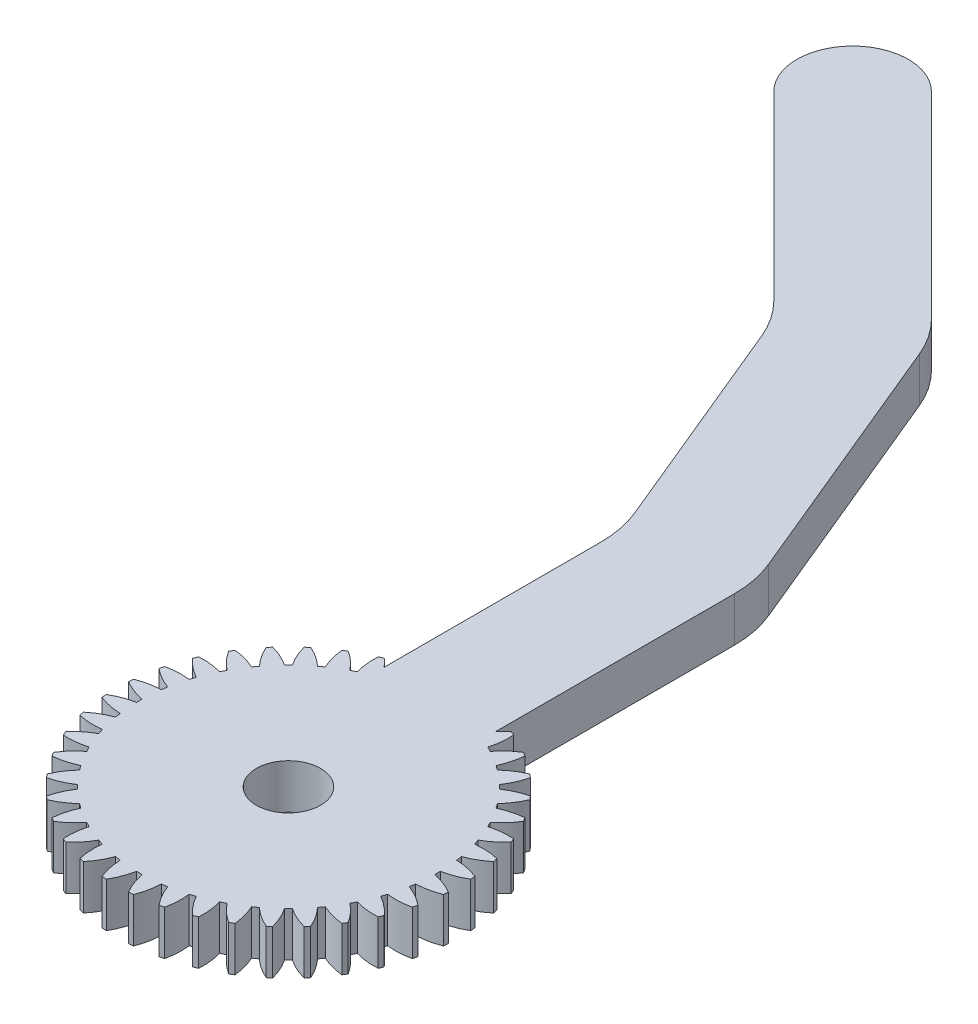
from build123d import *

# Parameters (mm, degrees)
SKETCH1_R           = 15.375
SKETCH1_R_2         = 2.875
BOSS_EXTRUDE1_DEPTH = 4
CUT_EXTRUDE1_DEPTH  = 23.108397726
CIRPATTERN1_COUNT   = 40
BOSS_EXTRUDE2_DEPTH = 4


with BuildPart() as part:
    # Sketch1 → Boss-Extrude1 (new body)
    with BuildSketch(Plane(origin=(0, 0, 0), x_dir=(1, 0, 0), z_dir=(0, 1, 0))):
        with Locations(Location((0, 0, 0), (0, 0, 270))):
            Circle(SKETCH1_R)
        with Locations(Location((0, 0, 0), (0, 0, 270))):
            Circle(SKETCH1_R_2, mode=Mode.SUBTRACT)
    extrude(amount=BOSS_EXTRUDE1_DEPTH)

    # Sketch2 → Cut-Extrude1 (cut, through all)
    with BuildSketch(Plane(origin=(0, 4, 0), x_dir=(1, 0, 0), z_dir=(0, 1, 0))):
        with BuildLine():
            Line((0, 15.375), (0, 13.375))
            ThreePointArc((0, 13.375), (0.12500546, 13.374415824), (0.25, 13.372663347))
            ThreePointArc((0.25, 13.372663347), (0.537827073, 14.390745616), (1, 15.342445209))
            ThreePointArc((1, 15.342445209), (0.500264883, 15.366859147), (0, 15.375))
        make_face()
        with BuildLine():
            ThreePointArc((-0.25, 13.372663347), (-0.12500546, 13.374415824), (0, 13.375))
            Line((0, 13.375), (0, 15.375))
            ThreePointArc((0, 15.375), (-0.500264883, 15.366859147), (-1, 15.342445209))
            ThreePointArc((-1, 15.342445209), (-0.537827073, 14.390745616), (-0.25, 13.372663347))
        make_face()
    cut_extrude1 = extrude(amount=-CUT_EXTRUDE1_DEPTH, mode=Mode.SUBTRACT)

    # CirPattern1: Cut-Extrude1 ×40 about axis
    cirpattern1_axis = Axis((0, 0, 0), (0, 1, 0))
    for i in range(1, CIRPATTERN1_COUNT):
        add(cut_extrude1.rotate(cirpattern1_axis, i * 360 / CIRPATTERN1_COUNT), mode=Mode.SUBTRACT)

    # Sketch3 → Boss-Extrude2 (add)
    with BuildSketch(Plane(origin=(0, 4, 0), x_dir=(1, 0, 0), z_dir=(0, 1, 0))):
        with BuildLine():
            Line((5, 10), (-5, 10))
            Line((-5, 10), (-5, 33.010876326))
            ThreePointArc((-5, 33.010876326), (-5.192147196, 34.961779546), (-5.761204675, 36.83771065))
            Line((-5.761204675, 36.83771065), (-13.805881134, 56.259277663))
            ThreePointArc((-13.805881134, 56.259277663), (-14.729980336, 57.988145669), (-15.973608647, 59.503511151))
            Line((-15.973608647, 59.503511151), (-32.244755339, 75.774657842))
            ThreePointArc((-32.244755339, 75.774657842), (-32.244755339, 82.845725654), (-25.173687527, 82.845725654))
            Line((-25.173687527, 82.845725654), (-7.496017997, 65.168056125))
            ThreePointArc((-7.496017997, 65.168056125), (-6.252389686, 63.652690643), (-5.328290484, 61.923822636))
            Line((-5.328290484, 61.923822636), (4.238795325, 38.826834324))
            ThreePointArc((4.238795325, 38.826834324), (4.807852804, 36.95090322), (5, 35))
            Line((5, 35), (5, 10))
        make_face()
    extrude(amount=-BOSS_EXTRUDE2_DEPTH)


solid = part.part
